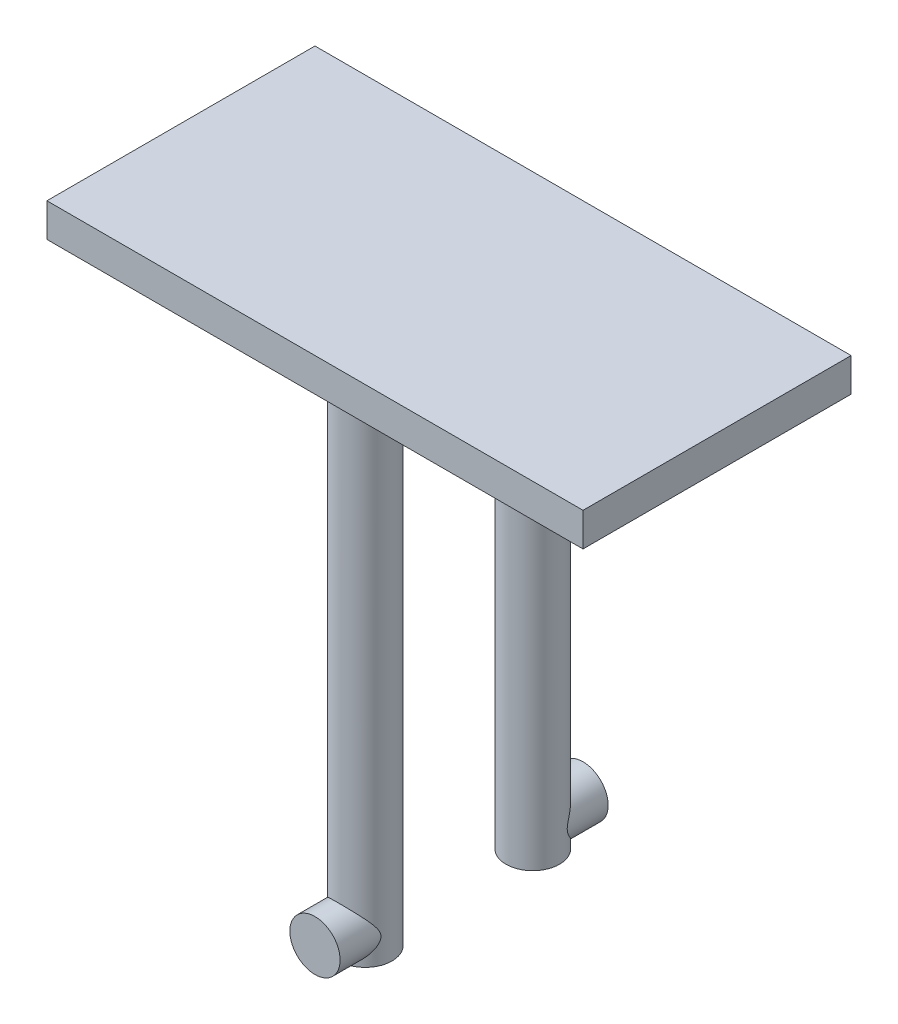
from build123d import *

# Parameters (mm, degrees)
SKETCH_1_W      = 160
SKETCH_1_H      = 80
EXTRUDE_1_DEPTH = 10
SKETCH_2_R      = 8
EXTRUDE_2_DEPTH = 150
SKETCH_3_R      = 7.5
EXTRUDE_3_DEPTH = 15
EXTRUDE_START   = -15
SKETCH_4_R      = 7.5
EXTRUDE_4_DEPTH = 15


with BuildPart() as part:
    # 草图1 → 凸台-拉伸1 (new body)
    with BuildSketch(Plane(origin=(0, 0, 0), x_dir=(1, 0, 0), z_dir=(0, 1, 0))):
        Rectangle(SKETCH_1_W, SKETCH_1_H)
    extrude(amount=EXTRUDE_1_DEPTH)

    # 草图2 → 凸台-拉伸2 (add)
    with BuildSketch(Plane.XZ):
        with Locations(Location((0, 25, 0), (0, 0, 90))):
            Circle(SKETCH_2_R)
        with Locations(Location((0, -25, 0), (0, 0, 90))):
            Circle(SKETCH_2_R)
    extrude(amount=EXTRUDE_2_DEPTH)

    # 草图3 → 凸台-拉伸3 (add)
    with BuildSketch(Plane(origin=(0, 0, -40), x_dir=(-1, 0, 0), z_dir=(0, 0, -1))):
        with Locations((0, -142.5)):
            Circle(SKETCH_3_R)
    extrude(amount=-EXTRUDE_3_DEPTH)

    # 草图4 → 凸台-拉伸4 (add)
    with BuildSketch(Plane.XY.offset(40).offset(EXTRUDE_START)):
        with Locations(Location((0, -142.5, 0), (0, 0, 180))):
            Circle(SKETCH_4_R)
    extrude(amount=EXTRUDE_4_DEPTH)


solid = part.part
